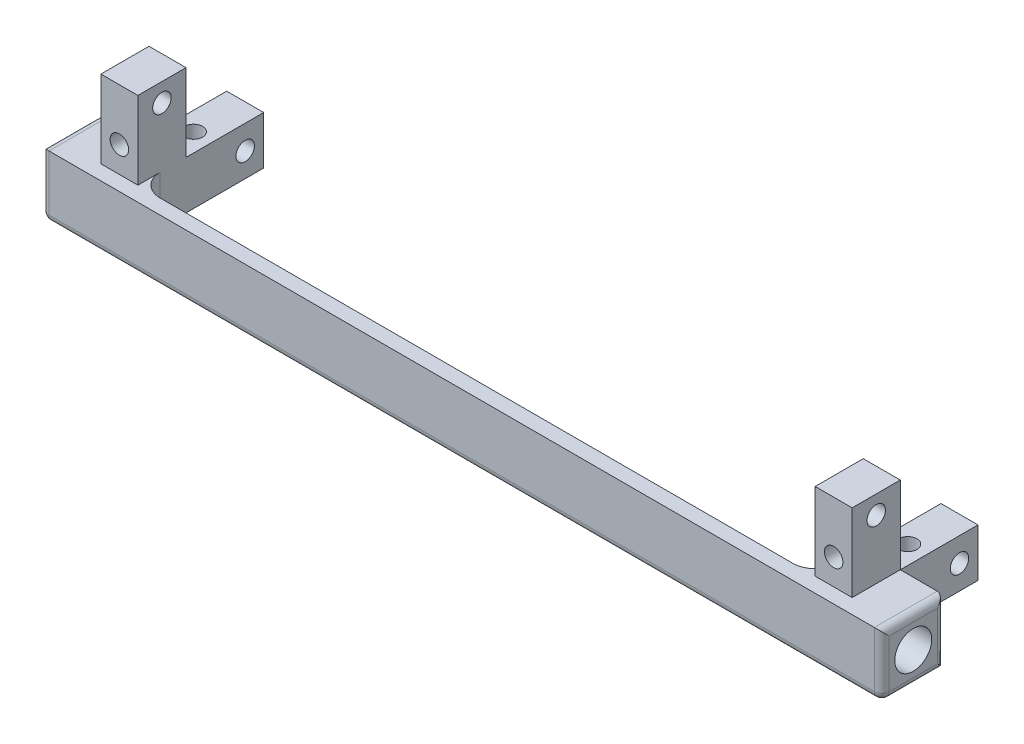
from build123d import *

# Parameters (mm, degrees)
SKETCH1_W                 = 113.5
SKETCH1_H                 = 8.5
BOSS_EXTRUDE1_DEPTH       = 8.5
BOSS_EXTRUDE2_DEPTH       = 5
BOSS_EXTRUDE3_DEPTH       = 5
SKETCH13_W                = 91.5
SKETCH13_H                = 6.5
CUT_EXTRUDE1_DEPTH        = 6.5
M3X0_5_TAPPED_HOLE1_D     = 2.5
M3X0_5_TAPPED_HOLE1_DEPTH = 7.5
M3X0_5_TAPPED_HOLE1_TIP   = 0.751075774
M3X0_5_TAPPED_HOLE2_D     = 2.5
M3X0_5_TAPPED_HOLE2_DEPTH = 5
M3X0_5_TAPPED_HOLE3_D     = 2.5
M3X0_5_TAPPED_HOLE3_DEPTH = 5
M3X0_5_TAPPED_HOLE4_D     = 2.5
M3X0_5_TAPPED_HOLE4_DEPTH = 7.5
M3X0_5_TAPPED_HOLE4_TIP   = 0.751075774
FILLET1_R                 = 1
FILLET2_R                 = 1
FILLET3_R                 = 1
FILLET4_R                 = 3
M3X0_5_TAPPED_HOLE5_D     = 2.5
M3X0_5_TAPPED_HOLE5_DEPTH = 7.5
M3X0_5_TAPPED_HOLE5_TIP   = 0.751075774
M3X0_5_TAPPED_HOLE6_D     = 2.5
M3X0_5_TAPPED_HOLE6_DEPTH = 7.5
M3X0_5_TAPPED_HOLE6_TIP   = 0.751075774
M3X0_5_TAPPED_HOLE7_D     = 2.5
M3X0_5_TAPPED_HOLE7_DEPTH = 7.5
M3X0_5_TAPPED_HOLE7_TIP   = 0.751075774
M3X0_5_TAPPED_HOLE9_D     = 2.5
M3X0_5_TAPPED_HOLE9_DEPTH = 7.5
M3X0_5_TAPPED_HOLE9_TIP   = 0.751075774
SKETCH43_W                = 10.5
SKETCH43_H                = 10.5
CUT_EXTRUDE3_DEPTH        = 110.01404726
SKETCH44_R                = 2.5
CUT_EXTRUDE4_DEPTH        = 10
CUT_EXTRUDE5_REACH        = 107.072
SKETCH45_R                = 1.25
M6X1_0_TAPPED_HOLE0_D     = 5
M6X1_0_TAPPED_HOLE0_DEPTH = 3.01
M6X1_0_TAPPED_HOLE0_TIP   = 1.502151548


with BuildPart() as part:
    # Sketch1 → Boss-Extrude1 (new body)
    with BuildSketch(Plane.XY):
        Rectangle(SKETCH1_W, SKETCH1_H)
    extrude(amount=BOSS_EXTRUDE1_DEPTH)

    # Sketch4 → Boss-Extrude2 (add)
    with BuildSketch(Plane(origin=(50.75, 0, 0), x_dir=(0, 0, -1), z_dir=(1, 0, 0))):
        Polygon((0, -2.25), (10.5, -2.25), (10.5, 14.75), (-6.5, 14.75), (-6.5, 4.25), (0, 4.25), align=None)
    extrude(amount=-BOSS_EXTRUDE2_DEPTH)

    # Sketch12 → Boss-Extrude3 (add)
    with BuildSketch(Plane.ZY.offset(50.75)):
        Polygon((6.5, 4.25), (6.5, 14.75), (-10.5, 14.75), (-10.5, -2.25), (0, -2.25), (0, 4.25), align=None)
    extrude(amount=-BOSS_EXTRUDE3_DEPTH)

    # Sketch13 → Cut-Extrude1 (cut)
    with BuildSketch(Plane(origin=(0, 4.25, 0), x_dir=(1, 0, 0), z_dir=(0, 1, 0))):
        with Locations((0, -3.25)):
            Rectangle(SKETCH13_W, SKETCH13_H)
    extrude(amount=-CUT_EXTRUDE1_DEPTH, mode=Mode.SUBTRACT)

    # M3x0.5 Tapped Hole1
    with Locations(Plane.XY.offset(6.5)):
        with Locations((-48.25, 7.75)):
            Hole(M3X0_5_TAPPED_HOLE1_D / 2, depth=M3X0_5_TAPPED_HOLE1_DEPTH)
            with Locations((0, 0, -(M3X0_5_TAPPED_HOLE1_DEPTH + M3X0_5_TAPPED_HOLE1_TIP / 2))):  # 118° drill point
                Cone(0, M3X0_5_TAPPED_HOLE1_D / 2, M3X0_5_TAPPED_HOLE1_TIP, mode=Mode.SUBTRACT)

    # M3x0.5 Tapped Hole2
    with Locations(Plane.ZY.offset(50.75)):
        with Locations((3.25, 12.25)):
            Hole(M3X0_5_TAPPED_HOLE2_D / 2, depth=M3X0_5_TAPPED_HOLE2_DEPTH)

    # M3x0.5 Tapped Hole3
    with Locations(Plane.ZY.offset(50.75)):
        with Locations((-8, 1)):
            Hole(M3X0_5_TAPPED_HOLE3_D / 2, depth=M3X0_5_TAPPED_HOLE3_DEPTH)

    # M3x0.5 Tapped Hole4
    with Locations(Plane.XZ.offset(2.25)):
        with Locations((-48.25, -3.5)):
            Hole(M3X0_5_TAPPED_HOLE4_D / 2, depth=M3X0_5_TAPPED_HOLE4_DEPTH)
            with Locations((0, 0, -(M3X0_5_TAPPED_HOLE4_DEPTH + M3X0_5_TAPPED_HOLE4_TIP / 2))):  # 118° drill point
                Cone(0, M3X0_5_TAPPED_HOLE4_D / 2, M3X0_5_TAPPED_HOLE4_TIP, mode=Mode.SUBTRACT)

    # Fillet1
    fillet1_edges = [part.edges().sort_by_distance(p)[0] for p in [
        (0, -4.25, 8.5),
    ]]
    fillet(fillet1_edges, radius=FILLET1_R)

    # Fillet2
    fillet2_edges = [part.edges().sort_by_distance(p)[0] for p in [
        (-56.75, 0.5, 8.5),
        (-56.75, 0, 0),
        (-56.75, 4.25, 4.25),
        (-56.75, -4.25, 3.75),
        (-56.75, -3.957106781, 8.207106781),
    ]]
    fillet(fillet2_edges, radius=FILLET2_R)

    # Fillet3
    fillet3_edges = [part.edges().sort_by_distance(p)[0] for p in [
        (56.75, 0, 0),
        (56.75, 4.25, 4.25),
        (56.75, 0.5, 8.5),
        (56.75, -4.25, 3.75),
        (56.75, -3.957106781, 8.207106781),
    ]]
    fillet(fillet3_edges, radius=FILLET3_R)

    # Fillet4
    fillet4_edges = [part.edges().sort_by_distance(p)[0] for p in [
        (-45.75, 1, 6.5),
        (45.75, 1, 6.5),
    ]]
    fillet(fillet4_edges, radius=FILLET4_R)

    # M3x0.5 Tapped Hole5
    with Locations(Plane.XY.offset(6.5)):
        with Locations((48.25, 7.75)):
            Hole(M3X0_5_TAPPED_HOLE5_D / 2, depth=M3X0_5_TAPPED_HOLE5_DEPTH)
            with Locations((0, 0, -(M3X0_5_TAPPED_HOLE5_DEPTH + M3X0_5_TAPPED_HOLE5_TIP / 2))):  # 118° drill point
                Cone(0, M3X0_5_TAPPED_HOLE5_D / 2, M3X0_5_TAPPED_HOLE5_TIP, mode=Mode.SUBTRACT)

    # M3x0.5 Tapped Hole6
    with Locations(Plane.XZ.offset(2.25)):
        with Locations((48.25, -3.5)):
            Hole(M3X0_5_TAPPED_HOLE6_D / 2, depth=M3X0_5_TAPPED_HOLE6_DEPTH)
            with Locations((0, 0, -(M3X0_5_TAPPED_HOLE6_DEPTH + M3X0_5_TAPPED_HOLE6_TIP / 2))):  # 118° drill point
                Cone(0, M3X0_5_TAPPED_HOLE6_D / 2, M3X0_5_TAPPED_HOLE6_TIP, mode=Mode.SUBTRACT)

    # M3x0.5 Tapped Hole7
    with Locations(Plane(origin=(50.75, 0, 0), x_dir=(0, 0, -1), z_dir=(1, 0, 0))):
        with Locations((8, 1)):
            Hole(M3X0_5_TAPPED_HOLE7_D / 2, depth=M3X0_5_TAPPED_HOLE7_DEPTH)
            with Locations((0, 0, -(M3X0_5_TAPPED_HOLE7_DEPTH + M3X0_5_TAPPED_HOLE7_TIP / 2))):  # 118° drill point
                Cone(0, M3X0_5_TAPPED_HOLE7_D / 2, M3X0_5_TAPPED_HOLE7_TIP, mode=Mode.SUBTRACT)

    # M3x0.5 Tapped Hole9
    with Locations(Plane(origin=(50.75, 0, 0), x_dir=(0, 0, -1), z_dir=(1, 0, 0))):
        with Locations((-3.25, 12.25)):
            Hole(M3X0_5_TAPPED_HOLE9_D / 2, depth=M3X0_5_TAPPED_HOLE9_DEPTH)
            with Locations((0, 0, -(M3X0_5_TAPPED_HOLE9_DEPTH + M3X0_5_TAPPED_HOLE9_TIP / 2))):  # 118° drill point
                Cone(0, M3X0_5_TAPPED_HOLE9_D / 2, M3X0_5_TAPPED_HOLE9_TIP, mode=Mode.SUBTRACT)

    # Sketch43 → Cut-Extrude3 (cut, through all)
    with BuildSketch(Plane.ZY.offset(50.75)):
        with Locations((-5.25, 9.5)):
            Rectangle(SKETCH43_W, SKETCH43_H)
    extrude(amount=-CUT_EXTRUDE3_DEPTH, mode=Mode.SUBTRACT)

    # Sketch44 → Cut-Extrude4 (cut)
    with BuildSketch(Plane(origin=(56.75, 0, 0), x_dir=(0, 0, -1), z_dir=(1, 0, 0))):
        with Locations((-4.25, 0)):
            Circle(SKETCH44_R)
    extrude(amount=-CUT_EXTRUDE4_DEPTH, mode=Mode.SUBTRACT)

    # Sketch45 → Cut-Extrude5 (cut, up to next)
    with BuildSketch(Plane(origin=(46.75, 0, 0), x_dir=(0, 0, -1), z_dir=(1, 0, 0)), mode=Mode.PRIVATE) as cut_extrude5_sk1:
        with Locations((-4.25, 0)):
            Circle(SKETCH45_R)
    cut_extrude5_tool1 = extrude(cut_extrude5_sk1.sketch, amount=-CUT_EXTRUDE5_REACH, mode=Mode.PRIVATE) & part.part
    add(cut_extrude5_tool1.solids().sort_by_distance((46.75, 0, 4.25))[0], mode=Mode.SUBTRACT)

    # M6x1.0 Tapped Hole0
    with Locations(Plane(origin=(56.75, 0, 0), x_dir=(0, 0, -1), z_dir=(1, 0, 0))):
        with Locations((-4.25, 0)):
            Hole(M6X1_0_TAPPED_HOLE0_D / 2, depth=M6X1_0_TAPPED_HOLE0_DEPTH)
            with Locations((0, 0, -(M6X1_0_TAPPED_HOLE0_DEPTH + M6X1_0_TAPPED_HOLE0_TIP / 2))):  # 118° drill point
                Cone(0, M6X1_0_TAPPED_HOLE0_D / 2, M6X1_0_TAPPED_HOLE0_TIP, mode=Mode.SUBTRACT)


solid = part.part
